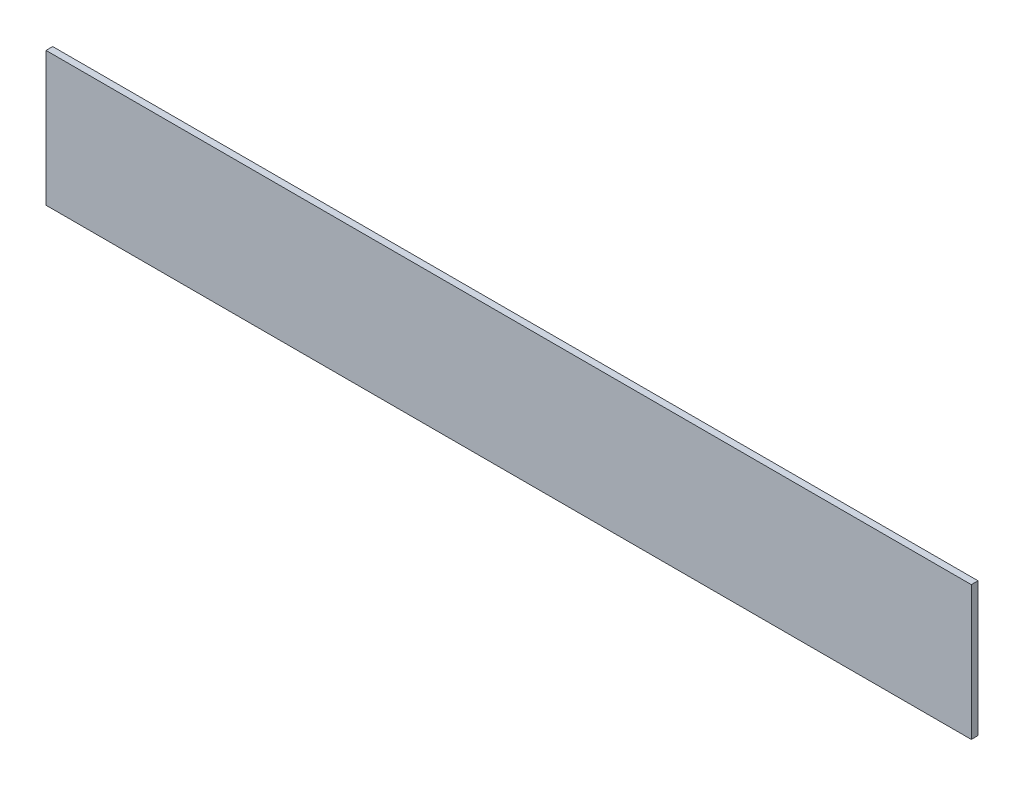
from build123d import *

# Parameters (mm, degrees)
SKETCH1_W           = 1380
SKETCH1_H           = 200
BOSS_EXTRUDE1_DEPTH = 10


with BuildPart() as part:
    # Sketch1 → Boss-Extrude1 (new body)
    with BuildSketch(Plane.XY):
        Rectangle(SKETCH1_W, SKETCH1_H)
    extrude(amount=BOSS_EXTRUDE1_DEPTH)


solid = part.part
